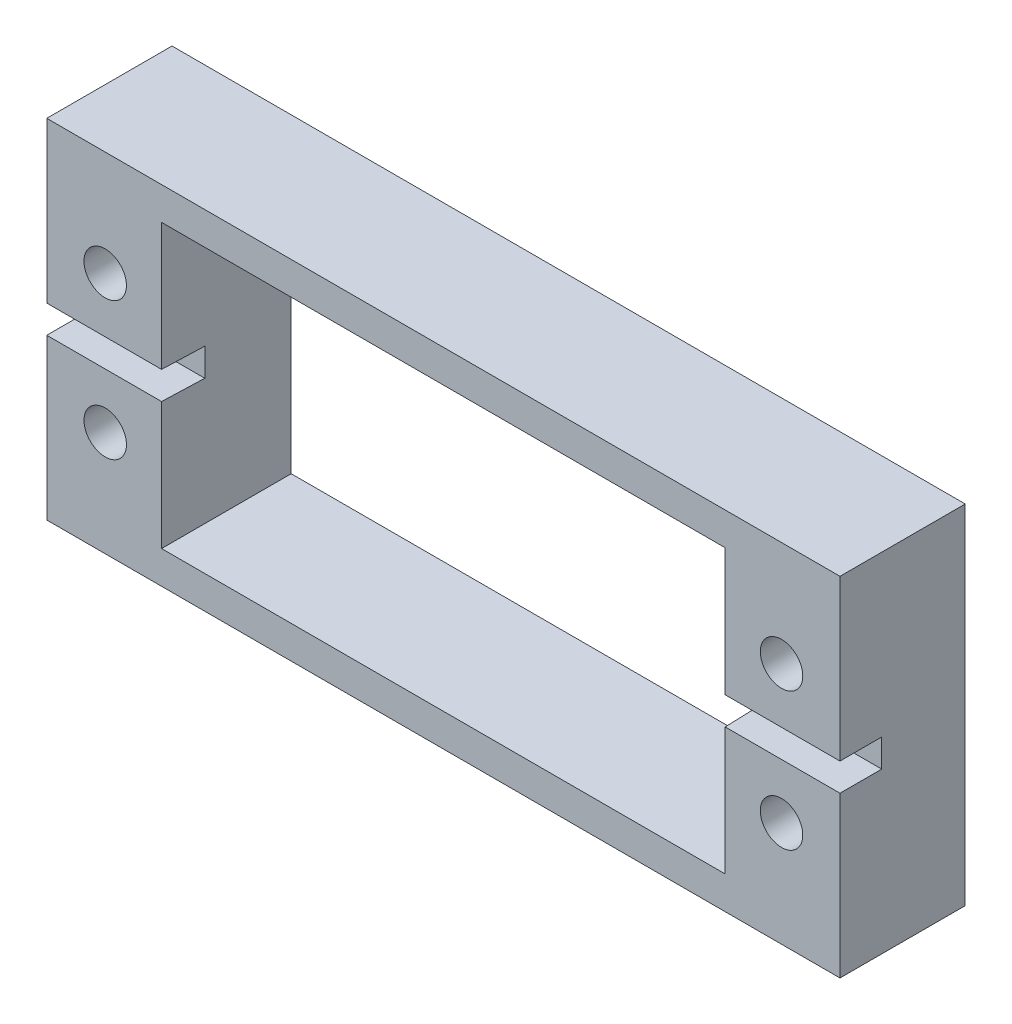
from build123d import *

# Parameters (mm, degrees)
SKETCH_1_W          = 57
SKETCH_1_H          = 25
SKETCH_1_R          = 1.525
EXTRUDE_1_DEPTH     = 9
SKETCH_2_W          = 57
SKETCH_2_H          = 2
CUT_EXTRUDE_1_DEPTH = 3
SKETCH_3_W          = 40.5
SKETCH_3_H          = 20.3
CUT_EXTRUDE_2_DEPTH = 15
CUT_EXTRUDE_2_DRAFT = -2


with BuildPart() as part:
    # 草图1 → 凸台-拉伸1 (new body)
    with BuildSketch(Plane.XY):
        Rectangle(SKETCH_1_W, SKETCH_1_H)
        with Locations((24.3, 4.95)):
            Circle(SKETCH_1_R, mode=Mode.SUBTRACT)
        with Locations(Location((-24.3, 4.95, 0), (0, 0, 180))):
            Circle(SKETCH_1_R, mode=Mode.SUBTRACT)
        with Locations((-24.3, -4.95)):
            Circle(SKETCH_1_R, mode=Mode.SUBTRACT)
        with Locations(Location((24.3, -4.95, 0), (0, 0, 180))):
            Circle(SKETCH_1_R, mode=Mode.SUBTRACT)
    extrude(amount=EXTRUDE_1_DEPTH)

    # 草图2 → 切除-拉伸1 (cut)
    with BuildSketch(Plane.XY.offset(9)):
        Rectangle(SKETCH_2_W, SKETCH_2_H)
    extrude(amount=-CUT_EXTRUDE_1_DEPTH, mode=Mode.SUBTRACT)


with BuildPart() as cut_extrude_2_tool:
    # 草图3 → 切除-拉伸2 (with draft: the straight prism first)
    with BuildSketch(Plane.XY.offset(9)):
        Rectangle(SKETCH_3_W, SKETCH_3_H)
    extrude(amount=-CUT_EXTRUDE_2_DEPTH)
    # 切除-拉伸2: the draft: its side faces are tilted about the plane it starts from
    cut_extrude_2_sides = [cut_extrude_2_tool.faces().sort_by_distance(p)[0] for p in [
        (0, -10.15, 1.5),
        (20.25, 0, 1.5),
        (0, 10.15, 1.5),
        (-20.25, 0, 1.5),
    ]]
    draft(cut_extrude_2_sides, Plane.XY.offset(9), CUT_EXTRUDE_2_DRAFT)


with BuildPart() as part_1:
    add(part.part)

    # 切除-拉伸2: cut by cut_extrude_2_tool
    add(cut_extrude_2_tool.part, mode=Mode.SUBTRACT)


solid = part_1.part
